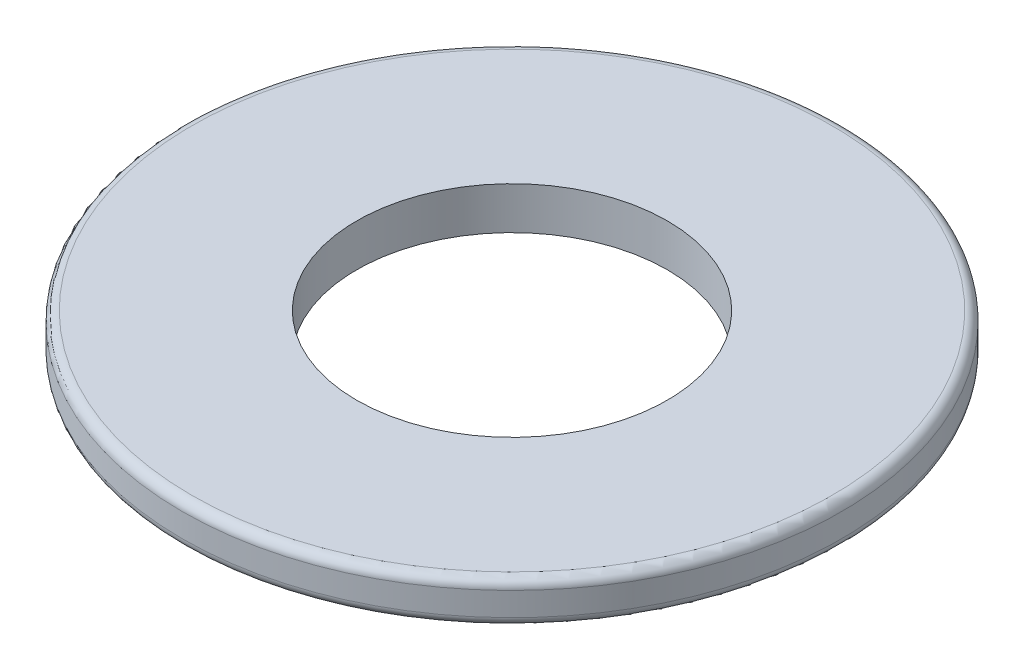
from build123d import *

# Parameters (mm, degrees)
SKETCH2_R           = 3.5
SKETCH2_R_2         = 1.65
BOSS_EXTRUDE1_DEPTH = 0.45
FILLET1_R           = 0.1


with BuildPart() as part:
    # Sketch2 → Boss-Extrude1 (new body)
    with BuildSketch(Plane(origin=(0, 0, 0), x_dir=(1, 0, 0), z_dir=(0, 1, 0))):
        with Locations(Location((0, 0, 0), (0, 0, 270))):
            Circle(SKETCH2_R)
        with Locations(Location((0, 0, 0), (0, 0, 270))):
            Circle(SKETCH2_R_2, mode=Mode.SUBTRACT)
    extrude(amount=BOSS_EXTRUDE1_DEPTH)

    # Fillet1
    fillet1_edges = [part.edges().sort_by_distance(p)[0] for p in [
        (0, 0, -3.5),
        (0, 0.45, -3.5),
    ]]
    fillet(fillet1_edges, radius=FILLET1_R)


solid = part.part
